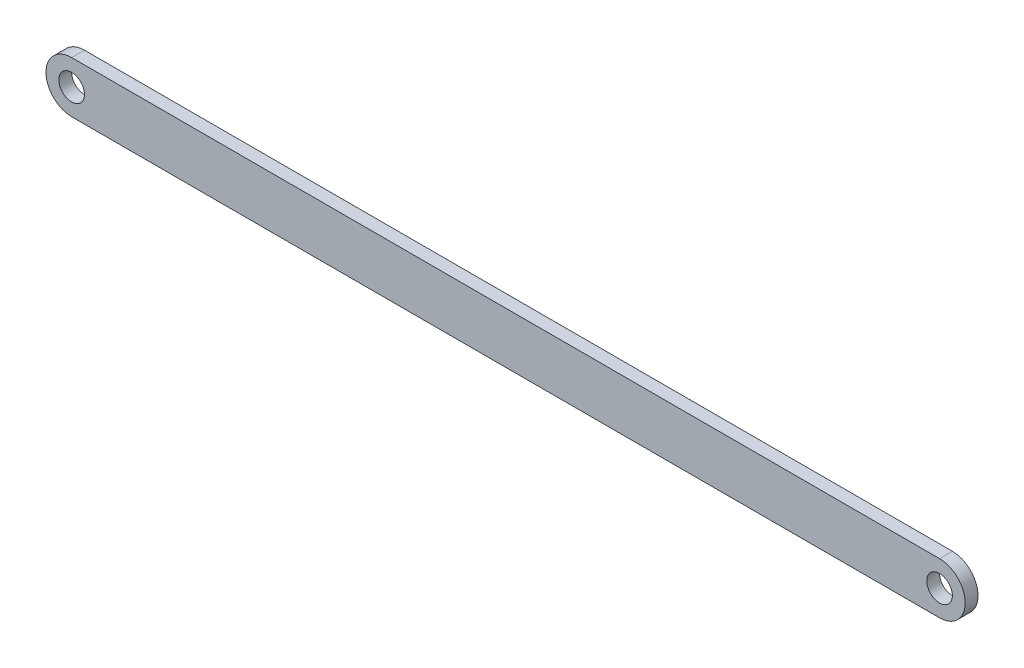
from build123d import *

# Parameters (mm, degrees)
ESBO_O1_R                = 1
RESSALTO_EXTRUS_O1_DEPTH = 1


with BuildPart() as part:
    # Esboço1 → Ressalto-extrusão1 (new body)
    with BuildSketch(Plane.XY):
        with BuildLine():
            Line((-33.855, 2), (33.855, 2))
            ThreePointArc((33.855, 2), (35.855, 0), (33.855, -2))
            Line((33.855, -2), (-33.855, -2))
            ThreePointArc((-33.855, -2), (-35.855, 0), (-33.855, 2))
        make_face()
        with Locations((-33.855, 0)):
            Circle(ESBO_O1_R, mode=Mode.SUBTRACT)
        with Locations((33.855, 0)):
            Circle(ESBO_O1_R, mode=Mode.SUBTRACT)
    extrude(amount=RESSALTO_EXTRUS_O1_DEPTH)


solid = part.part
